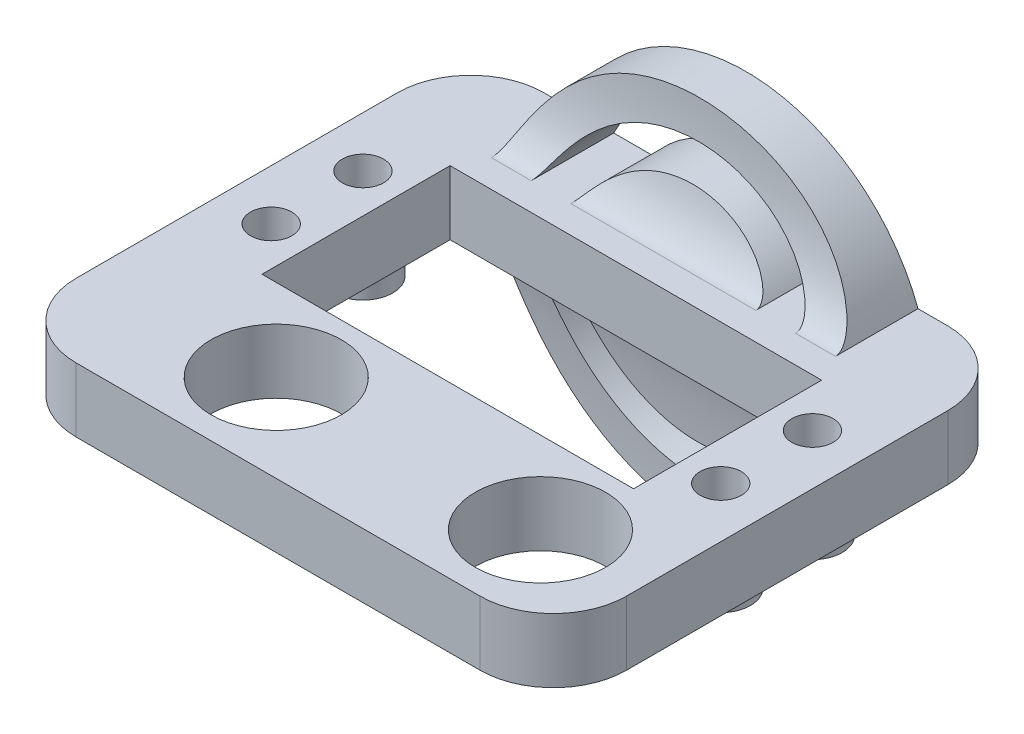
from build123d import *
from build123d.topology import SkipClean

# Parameters (mm, degrees)
SKETCH1_W           = 60
SKETCH1_H           = 42
SKETCH1_R           = 7.1
SKETCH1_R_2         = 2.25
SKETCH1_W_2         = 40.5
SKETCH1_H_2         = 20.5
BOSS_EXTRUDE1_DEPTH = 7
BOSS_EXTRUDE2_START = 2.9
SKETCH2_R           = 3.25
SKETCH2_R_2         = 2.25
BOSS_EXTRUDE2_DEPTH = 2.9
SKETCH3_R           = 20.02
SKETCH3_R_2         = 16.02
SKETCH3_R_3         = 12.27
SKETCH3_W           = 60
SKETCH3_H           = 7
BOSS_EXTRUDE3_DEPTH = 9
SKETCH4_RX          = 13.02
SKETCH4_RY          = 4
SKETCH4_RX_2        = 20.02
CUT_EXTRUDE1_DEPTH  = 71.005716909
FILLET1_R           = 8


with BuildPart() as part:
    # Sketch1 → Boss-Extrude1 (new body)
    with BuildSketch(Plane(origin=(0, 0, 0), x_dir=(1, 0, 0), z_dir=(0, 1, 0))):
        Rectangle(SKETCH1_W, SKETCH1_H)
        with Locations(Location((-9.75, -11.45, 0), (0, 0, 270))):
            Circle(SKETCH1_R, mode=Mode.SUBTRACT)
        with Locations(Location((19.05, -11.45, 0), (0, 0, 270))):
            Circle(SKETCH1_R, mode=Mode.SUBTRACT)
        with Locations(Location((24.5, 12.75, 0), (0, 0, 270))):
            Circle(SKETCH1_R_2, mode=Mode.SUBTRACT)
        with Locations(Location((24.5, 2.75, 0), (0, 0, 270))):
            Circle(SKETCH1_R_2, mode=Mode.SUBTRACT)
        with Locations(Location((-24.5, 2.75, 0), (0, 0, 90))):
            Circle(SKETCH1_R_2, mode=Mode.SUBTRACT)
        with Locations(Location((-24.5, 12.75, 0), (0, 0, 90))):
            Circle(SKETCH1_R_2, mode=Mode.SUBTRACT)
        with Locations((0, 7.75)):
            Rectangle(SKETCH1_W_2, SKETCH1_H_2, mode=Mode.SUBTRACT)
    extrude(amount=BOSS_EXTRUDE1_DEPTH)

    # Sketch2 → Boss-Extrude2 (add)
    # profile 1 of 4: a face of its own
    with SkipClean():  # the faces are left unmerged after this step: merging them gives an invalid solid
        with BuildSketch(Plane.XZ.offset(BOSS_EXTRUDE2_START)):
            with Locations(Location((24.5, -2.75, 0), (0, 0, 270))):
                Circle(SKETCH2_R)
            with Locations(Location((24.5, -2.75, 0), (0, 0, 270))):
                Circle(SKETCH2_R_2, mode=Mode.SUBTRACT)
        # profile 2 of 4: a face of its own
        with BuildSketch(Plane.XZ.offset(BOSS_EXTRUDE2_START)):
            with Locations(Location((24.5, -12.75, 0), (0, 0, 270))):
                Circle(SKETCH2_R)
            with Locations(Location((24.5, -12.75, 0), (0, 0, 270))):
                Circle(SKETCH2_R_2, mode=Mode.SUBTRACT)
        # profile 3 of 4: a face of its own
        with BuildSketch(Plane.XZ.offset(BOSS_EXTRUDE2_START)):
            with Locations(Location((-24.5, -12.75, 0), (0, 0, 90))):
                Circle(SKETCH2_R)
            with Locations(Location((-24.5, -12.75, 0), (0, 0, 270))):
                Circle(SKETCH2_R_2, mode=Mode.SUBTRACT)
        # profile 4 of 4: a face of its own
        with BuildSketch(Plane.XZ.offset(BOSS_EXTRUDE2_START)):
            with Locations(Location((-24.5, -2.75, 0), (0, 0, 90))):
                Circle(SKETCH2_R)
            with Locations(Location((-24.5, -2.75, 0), (0, 0, 270))):
                Circle(SKETCH2_R_2, mode=Mode.SUBTRACT)
        extrude(amount=-BOSS_EXTRUDE2_DEPTH)

    # Sketch3 → Boss-Extrude3 (add)
    # profile 1 of 3: a face of its own
    with SkipClean():  # the faces are left unmerged after this step: merging them gives an invalid solid
        with BuildSketch(Plane(origin=(0, 0, -21), x_dir=(-1, 0, 0), z_dir=(0, 0, -1))):
            Circle(SKETCH3_R)
            Circle(SKETCH3_R_2, mode=Mode.SUBTRACT)
        # profile 2 of 3: a face of its own
        with BuildSketch(Plane(origin=(0, 0, -21), x_dir=(-1, 0, 0), z_dir=(0, 0, -1))):
            Circle(SKETCH3_R_3)
        # profile 3 of 3: a face of its own
        with BuildSketch(Plane(origin=(0, 0, -21), x_dir=(-1, 0, 0), z_dir=(0, 0, -1))):
            with Locations((0, 3.5)):
                Rectangle(SKETCH3_W, SKETCH3_H)
        extrude(amount=BOSS_EXTRUDE3_DEPTH)

    # Sketch4 → Cut-Extrude1 (cut, through all)
    with SkipClean():  # the faces are left unmerged after this step: merging them gives an invalid solid
        with BuildSketch(Plane.ZY.offset(30)):
            with Locations(Location((-21, 20.02), (0, 0, -90))):
                Ellipse(SKETCH4_RX, SKETCH4_RY)
            with Locations(Location((-21, -20.02), (0, 0, 90))):
                Ellipse(SKETCH4_RX_2, SKETCH4_RY)
        extrude(amount=-CUT_EXTRUDE1_DEPTH, mode=Mode.SUBTRACT)

    # Fillet1
    fillet1_edges = [part.edges().sort_by_distance(p)[0] for p in [
        (30, 3.5, 21),
        (-30, 3.5, 21),
        (-30, 3.5, -30),
        (30, 3.5, -30),
    ]]
    fillet(fillet1_edges, radius=FILLET1_R)


solid = part.part
